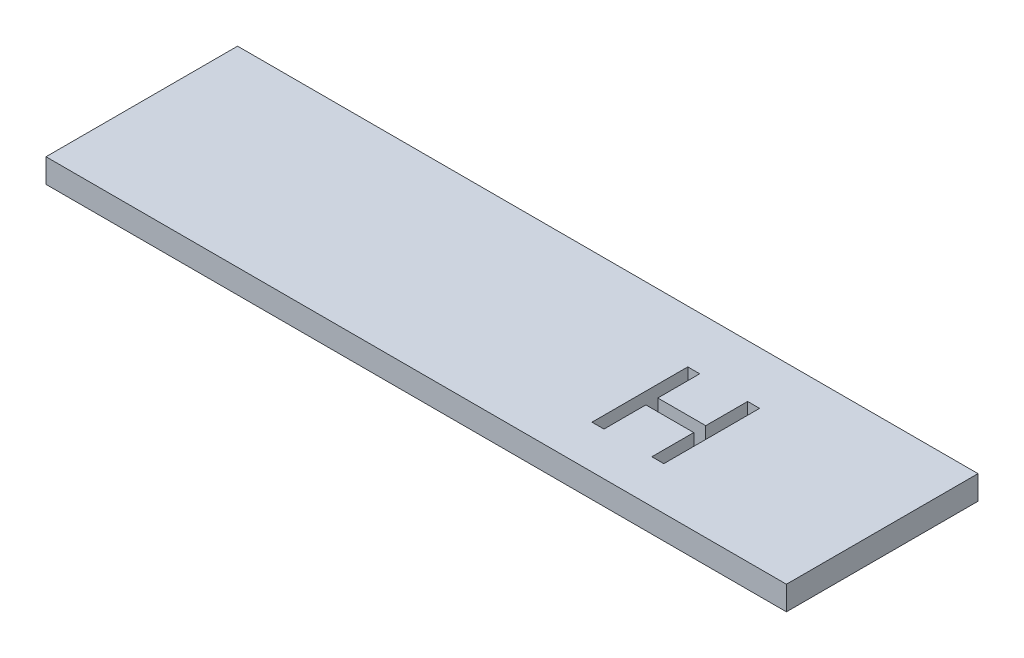
from build123d import *

# Parameters (mm, degrees)
SKETCH1_W           = 196.342
SKETCH1_H           = 50.8
BOSS_EXTRUDE1_DEPTH = 6.35
CUT_EXTRUDE1_DEPTH  = 7.62


with BuildPart() as part:
    # Sketch1 → Boss-Extrude1 (new body)
    with BuildSketch(Plane(origin=(0, 0, 0), x_dir=(1, 0, 0), z_dir=(0, 1, 0))):
        with Locations((98.171, 25.4)):
            Rectangle(SKETCH1_W, SKETCH1_H)
    extrude(amount=BOSS_EXTRUDE1_DEPTH)

    # Sketch2 → Cut-Extrude1 (cut)
    with BuildSketch(Plane.XZ):
        Polygon((136.525, -25.7175), (136.525, -36.83), (133.35, -36.83), (133.35, -11.43), (136.525, -11.43), (136.525, -22.5425), (149.225, -22.5425), (149.225, -11.43), (152.4, -11.43), (152.4, -36.83), (149.225, -36.83), (149.225, -25.7175), align=None)
    extrude(amount=-CUT_EXTRUDE1_DEPTH, mode=Mode.SUBTRACT)


solid = part.part
